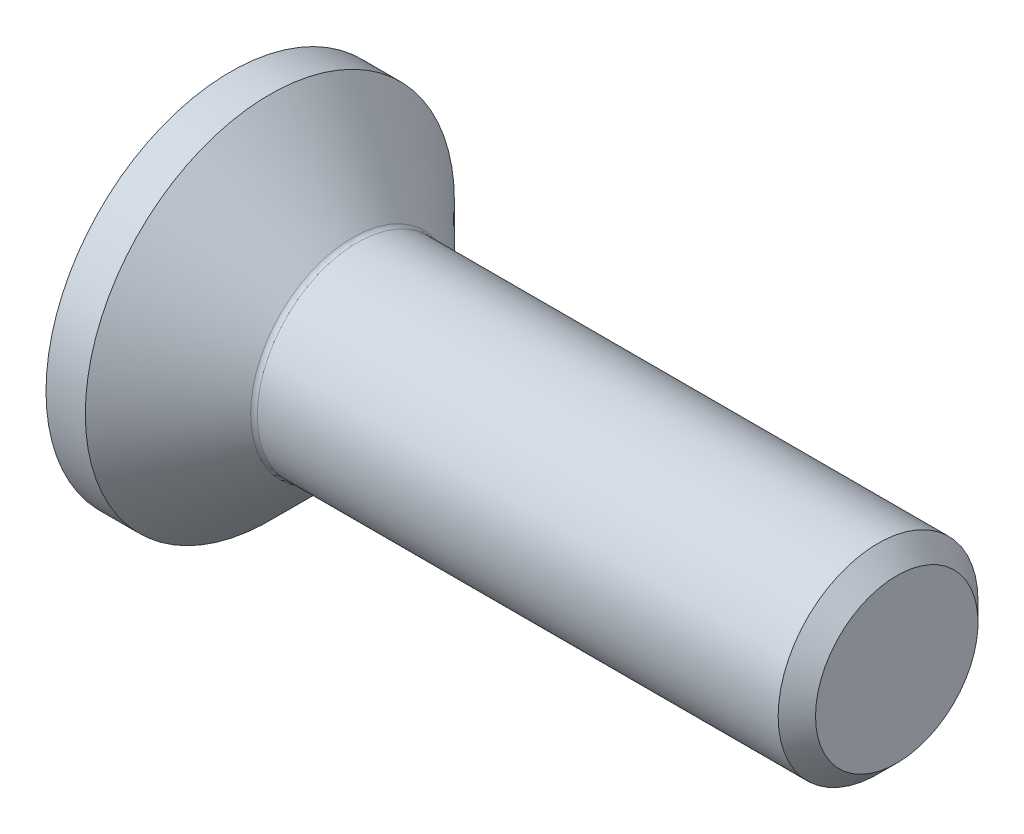
from build123d import *

# Parameters (mm, degrees)
FILLET1_R   = 0.1
HEX_2_DEPTH = 1.1


with BuildPart() as part:
    # BodySke → BaseBody (revolve)
    with BuildSketch(Plane.XY, mode=Mode.PRIVATE) as basebody_sk:
        Polygon((0, 0), (0, 2.77), (0.59, 2.77), (1.86, 1.5), (9.7195, 1.5), (10, 1.2195), (10, 0), align=None)
    revolve(basebody_sk.sketch.rotate(Axis((0, 0, 0), (1, 0, 0)), 90), axis=Axis((0, 0, 0), (1, 0, 0)))

    # Fillet1
    fillet1_edges = [part.edges().sort_by_distance(p)[0] for p in [
        (1.86, 0, -1.5),
    ]]
    fillet(fillet1_edges, radius=FILLET1_R)

    # Sketch2 → PreBroach (revolve, cut)
    with BuildSketch(Plane.XY, mode=Mode.PRIVATE) as prebroach_sk:
        Polygon((0, 1), (1.1, 1), (1.677350269, 0), (0, 0), align=None)
    revolve(prebroach_sk.sketch.rotate(Axis((0, 0, 0), (1, 0, 0)), 90), axis=Axis((0, 0, 0), (1, 0, 0)), mode=Mode.SUBTRACT)

    # Sketch3 → Hex 2 (cut)
    with BuildSketch(Plane.ZY):
        Polygon((-1, -0.577350269), (-1, 0.577350269), (0, 1.154700538), (1, 0.577350269), (1, -0.577350269), (0, -1.154700538), align=None)
    extrude(amount=-HEX_2_DEPTH, mode=Mode.SUBTRACT)


solid = part.part
